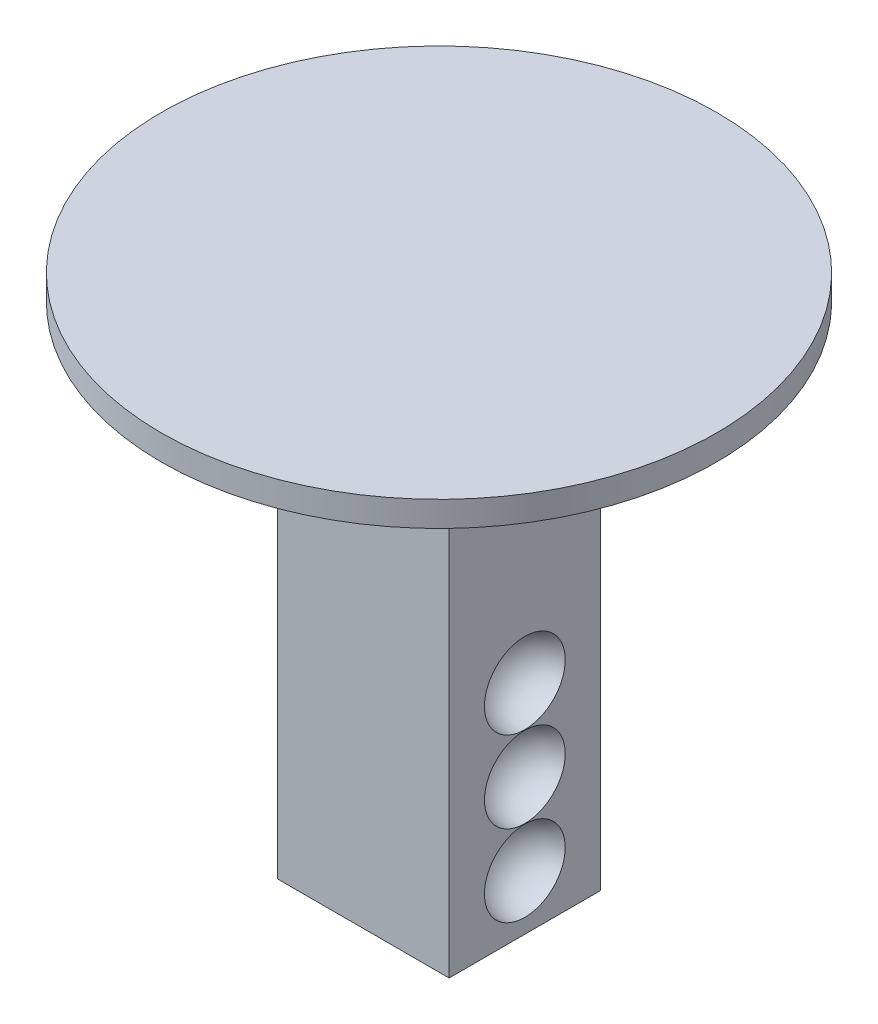
from build123d import *
from build123d.topology import SkipClean

# Parameters (mm, degrees)
SKETCH_5_W                 = 17
SKETCH_5_H                 = 100
EXTRUDE_1_DEPTH            = 15
PATTERN_LINEAR_1_COUNT     = 2
PATTERN_LINEAR_1_PITCH     = 16.1
PATTERN_LINEAR_1_COL_COUNT = 2
PATTERN_LINEAR_1_COL_PITCH = 16.1
SKETCH_8_W                 = 8
SKETCH_8_H                 = 22
SKETCH_9_W                 = 55
SKETCH_9_H                 = 5


with BuildPart() as part:
    # 草图5 → 凸台-拉伸1 (new, symmetric)
    with BuildSketch(Plane.XY):
        with Locations((-8.5, 20)):
            Rectangle(SKETCH_5_W, SKETCH_5_H)
    extrude_1 = extrude(amount=EXTRUDE_1_DEPTH, both=True)

    # 草图7 → 切除-旋转1 (revolve, cut)
    with BuildSketch(Plane.XY):
        with BuildLine():
            Line((-17, 5), (-17, -11))
            ThreePointArc((-17, -11), (-9, -3), (-17, 5))
        make_face()
    cut_revolve_1 = revolve(axis=Axis((-17, 5, 0), (0, -1, 0)), mode=Mode.SUBTRACT)

    # 阵列(线性)1: 切除-旋转1 ×2
    with Locations(*[(0, i * PATTERN_LINEAR_1_PITCH, 0) for i in range(1, PATTERN_LINEAR_1_COUNT)]):
        add(cut_revolve_1, mode=Mode.SUBTRACT)

    # 阵列(线性)1 col: 切除-旋转1 ×2
    with Locations(*[(0, -i * PATTERN_LINEAR_1_COL_PITCH, 0) for i in range(1, PATTERN_LINEAR_1_COL_COUNT)]):
        add(cut_revolve_1, mode=Mode.SUBTRACT)

    # 镜向2: 凸台-拉伸1 across plane
    add(extrude_1.mirror(Plane(origin=(0, 0, 0), x_dir=(0, 0, 1), z_dir=(1, 0, 0))))

    # 镜向3: 切除-旋转1 across plane
    with SkipClean():  # the faces are left unmerged after this step: merging them gives an invalid solid
        add(cut_revolve_1.mirror(Plane(origin=(0, 0, 0), x_dir=(0, 0, 1), z_dir=(1, 0, 0))), mode=Mode.SUBTRACT)

    # 镜向4 copy 1 sketch → 镜向4 copy 1 (revolve, cut)
    with SkipClean():  # the faces are left unmerged after this step: merging them gives an invalid solid
        with BuildSketch(Plane(origin=(0, 16.1, 0), x_dir=(-1, 0, 0), z_dir=(0, 0, 1))):
            with BuildLine():
                Line((-17, -5), (-17, 11))
                ThreePointArc((-17, 11), (-9, 3), (-17, -5))
            make_face()
        revolve(axis=Axis((17, 21.1, 0), (0, 1, 0)), mode=Mode.SUBTRACT)

    # 镜向4 copy 2 sketch → 镜向4 copy 2 (revolve, cut)
    with SkipClean():  # the faces are left unmerged after this step: merging them gives an invalid solid
        with BuildSketch(Plane(origin=(0, -16.1, 0), x_dir=(-1, 0, 0), z_dir=(0, 0, 1))):
            with BuildLine():
                Line((-17, -5), (-17, 11))
                ThreePointArc((-17, 11), (-9, 3), (-17, -5))
            make_face()
        revolve(axis=Axis((17, -11.1, 0), (0, 1, 0)), mode=Mode.SUBTRACT)

    # 镜向4 copy 3 sketch → 镜向4 copy 3 (revolve, cut)
    with SkipClean():  # the faces are left unmerged after this step: merging them gives an invalid solid
        with BuildSketch(Plane(origin=(0, 0, 0), x_dir=(-1, 0, 0), z_dir=(0, 0, 1))):
            with BuildLine():
                Line((-17, -5), (-17, 11))
                ThreePointArc((-17, 11), (-9, 3), (-17, -5))
            make_face()
        revolve(axis=Axis((17, 5, 0), (0, 1, 0)), mode=Mode.SUBTRACT)

    # 草图8 → 切除-旋转2 (revolve, cut)
    with SkipClean():  # the faces are left unmerged after this step: merging them gives an invalid solid
        with BuildSketch(Plane.XY):
            with Locations((-4, -19)):
                Rectangle(SKETCH_8_W, SKETCH_8_H)
        revolve(axis=Axis((0, -8, 0), (0, -1, 0)), mode=Mode.SUBTRACT)

    # 草图9 → 旋转1 (revolve)
    with SkipClean():  # the faces are left unmerged after this step: merging them gives an invalid solid
        with BuildSketch(Plane.XY):
            with Locations((27.5, 72.5)):
                Rectangle(SKETCH_9_W, SKETCH_9_H)
        revolve(axis=Axis((0, 70, 0), (0, 1, 0)))


solid = part.part
